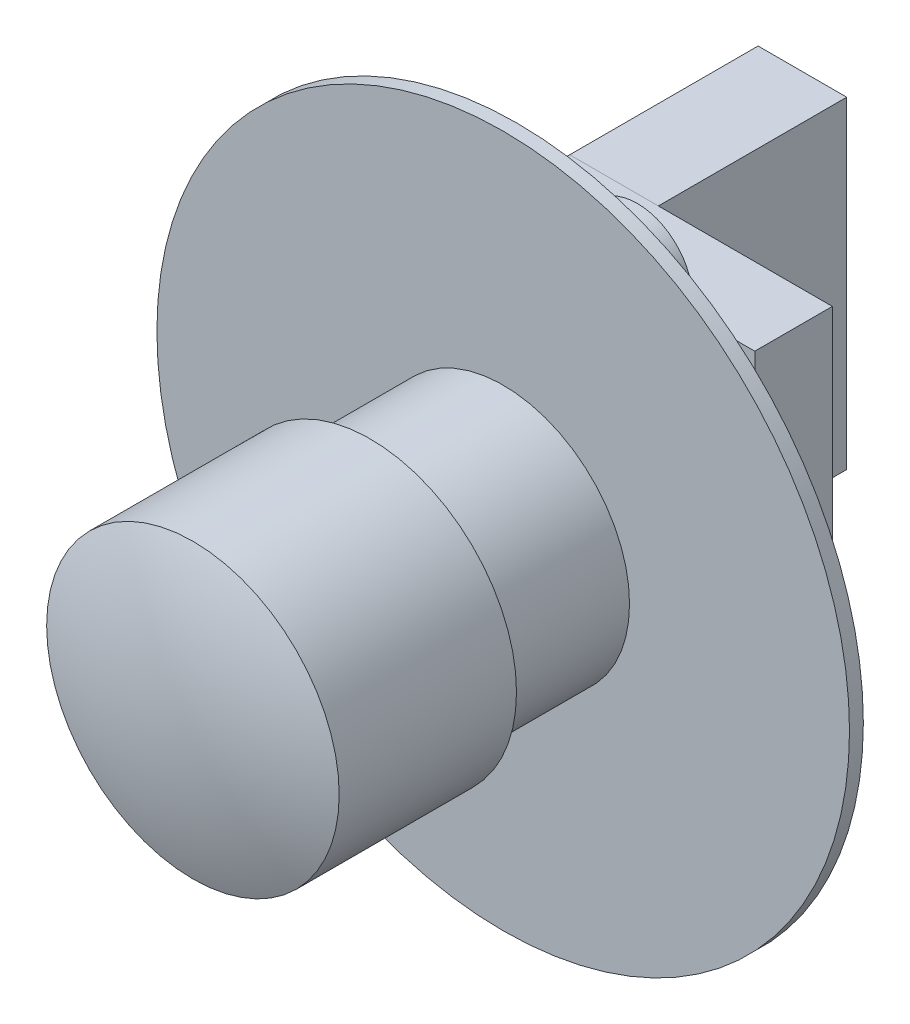
from build123d import *

# Parameters (mm, degrees)
SKETCH1_R           = 16.764
BOSS_EXTRUDE1_DEPTH = 20.32
SKETCH3_R           = 14.478
BOSS_EXTRUDE2_DEPTH = 15.24
SKETCH5_R           = 39.6875
BOSS_EXTRUDE4_DEPTH = 1.5875
SKETCH6_R           = 11.1125
BOSS_EXTRUDE5_DEPTH = 6.35
SKETCH7_R           = 14.605
BOSS_EXTRUDE6_DEPTH = 5.842
SKETCH8_W           = 30.099
SKETCH8_H           = 36.957
BOSS_EXTRUDE7_DEPTH = 8.89
BOSS_EXTRUDE8_DEPTH = 1.5875
SKETCH10_W          = 10.16
SKETCH10_H          = 36.957
BOSS_EXTRUDE9_DEPTH = 21.59


with BuildPart() as part:
    # Sketch1 → Boss-Extrude1 (new body)
    with BuildSketch(Plane.XY):
        Circle(SKETCH1_R)
    extrude(amount=BOSS_EXTRUDE1_DEPTH)

    # Sketch2 → Revolve1 (revolve)
    with BuildSketch(Plane(origin=(0, 0, 0), x_dir=(1, 0, 0), z_dir=(0, 1, 0)), mode=Mode.PRIVATE) as revolve1_sk:
        with BuildLine():
            Line((0, -20.32), (16.764, -20.32))
            ThreePointArc((16.764, -20.32), (8.531006989, -22.694256903), (0, -23.495))
            Line((0, -23.495), (0, -20.32))
        make_face()
    revolve(revolve1_sk.sketch.rotate(Axis((0, 0, 17.056334056), (0, 0, 1)), 180), axis=Axis((0, 0, 17.056334056), (0, 0, 1)))

    # Sketch3 → Boss-Extrude2 (add)
    with BuildSketch(Plane(origin=(0, 0, 0), x_dir=(-1, 0, 0), z_dir=(0, 0, -1))):
        with Locations(Location((0, 0, 0), (0, 0, 180))):
            Circle(SKETCH3_R)
    extrude(amount=BOSS_EXTRUDE2_DEPTH)

    # Sketch5 → Boss-Extrude4 (add)
    with BuildSketch(Plane(origin=(0, 0, -15.24), x_dir=(-1, 0, 0), z_dir=(0, 0, -1))):
        Circle(SKETCH5_R)
    extrude(amount=BOSS_EXTRUDE4_DEPTH)

    # Sketch6 → Boss-Extrude5 (add)
    with BuildSketch(Plane(origin=(0, 0, -16.8275), x_dir=(-1, 0, 0), z_dir=(0, 0, -1))):
        Circle(SKETCH6_R)
    extrude(amount=BOSS_EXTRUDE5_DEPTH)

    # Sketch7 → Boss-Extrude6 (add)
    with BuildSketch(Plane(origin=(0, 0, -23.1775), x_dir=(-1, 0, 0), z_dir=(0, 0, -1))):
        Circle(SKETCH7_R)
    extrude(amount=BOSS_EXTRUDE6_DEPTH)

    # Sketch8 → Boss-Extrude7 (add)
    with BuildSketch(Plane(origin=(0, 0, -29.0195), x_dir=(-1, 0, 0), z_dir=(0, 0, -1))):
        Rectangle(SKETCH8_W, SKETCH8_H)
    extrude(amount=BOSS_EXTRUDE7_DEPTH)

    # Sketch9 → Boss-Extrude8 (add)
    with BuildSketch(Plane.XY.offset(-29.0195)):
        with BuildLine():
            Line((6.35, 18.4785), (-6.35, 18.4785))
            ThreePointArc((-6.35, 18.4785), (0, 24.8285), (6.35, 18.4785))
        make_face()
    extrude(amount=-BOSS_EXTRUDE8_DEPTH)


with BuildPart() as body_2:
    # Sketch10 → Boss-Extrude9 (new body)
    with BuildSketch(Plane(origin=(0, 0, -37.9095), x_dir=(-1, 0, 0), z_dir=(0, 0, -1))):
        with Locations((9.9695, 0)):
            Rectangle(SKETCH10_W, SKETCH10_H)
    extrude(amount=BOSS_EXTRUDE9_DEPTH)


solid = Compound([part.part, body_2.part])
